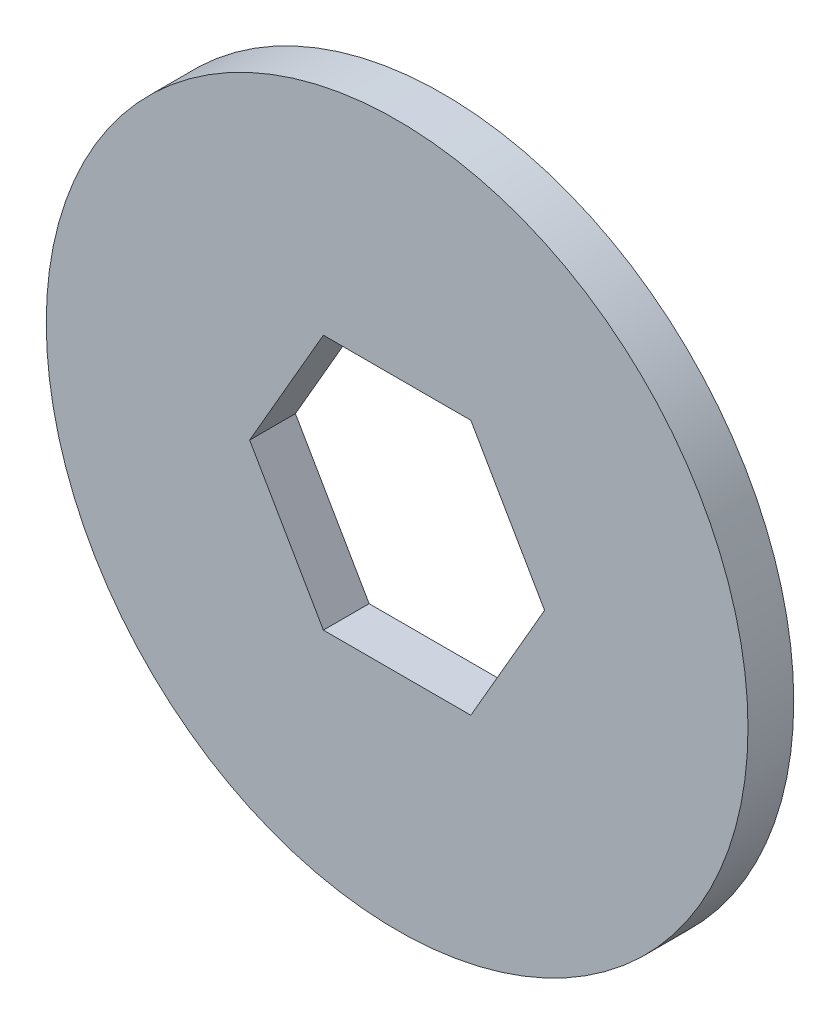
from build123d import *

# Parameters (mm, degrees)
SKETCH1_R               = 17.526
BOSS_EXTRUDE1_DEPTH     = 2.286
CUT_EXTRUDE1_DEPTH      = 25.890704048
CUT_EXTRUDE1_DEPTH_BACK = 25.890704048


with BuildPart() as part:
    # Sketch1 → Boss-Extrude1 (new body)
    with BuildSketch(Plane.XY):
        Circle(SKETCH1_R)
    extrude(amount=BOSS_EXTRUDE1_DEPTH)

    # Sketch2 → Cut-Extrude1 (cut, two sides: drawn at the far end of the back side and taken through both)
    with BuildSketch(Plane(origin=(0, 0, 0), x_dir=(-1, 0, 0), z_dir=(0, 0, -1)).offset(-CUT_EXTRUDE1_DEPTH_BACK)):
        Polygon((3.683, 6.379143124), (-3.683, 6.379143124), (-7.366, 0), (-3.683, -6.379143124), (3.683, -6.379143124), (7.366, 0), align=None)
    extrude(amount=CUT_EXTRUDE1_DEPTH + CUT_EXTRUDE1_DEPTH_BACK, mode=Mode.SUBTRACT)


solid = part.part
